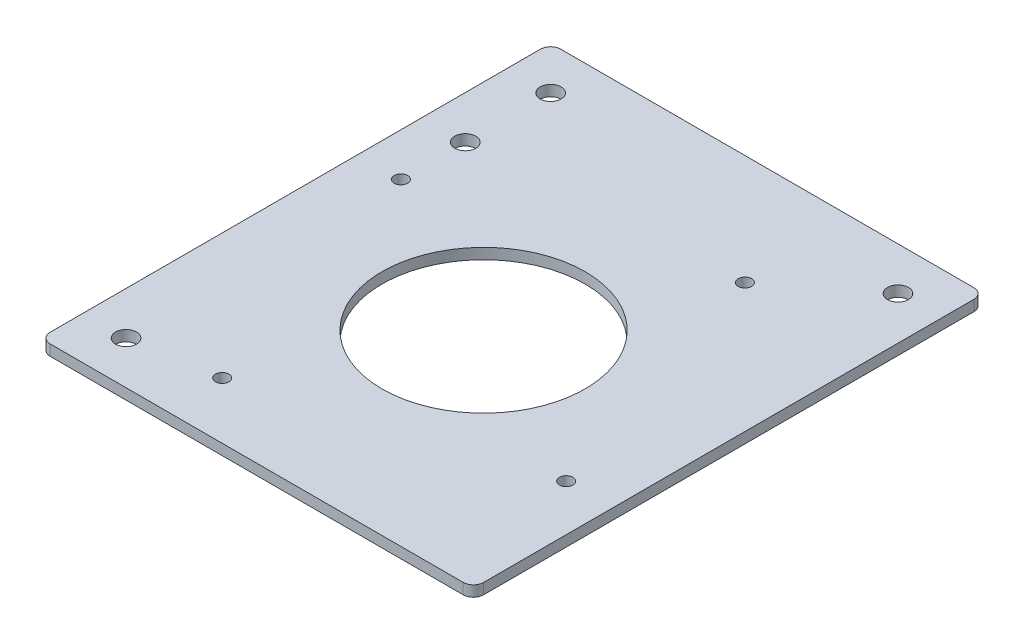
from build123d import *

# Parameters (mm, degrees)
SKETCH1_W           = 128
SKETCH1_H           = 150.8
SKETCH1_R           = 30
SKETCH1_R_2         = 3.1
BOSS_EXTRUDE1_DEPTH = 3.175
FILLET1_R           = 3
SKETCH3_R           = 1.985
CUT_EXTRUDE1_DEPTH  = 637.61018671


with BuildPart() as part:
    # Sketch1 → Boss-Extrude1 (new body)
    with BuildSketch(Plane(origin=(0, 0, 0), x_dir=(1, 0, 0), z_dir=(0, 1, 0))):
        with Locations((77.127334094, -545.362051651)):
            Rectangle(SKETCH1_W, SKETCH1_H)
        with Locations(Location((76.627334094, -553.262051651, 0), (0, 0, 270))):
            Circle(SKETCH1_R, mode=Mode.SUBTRACT)
        with Locations(Location((25.827334094, -482.662051651, 0), (0, 0, 270))):
            Circle(SKETCH1_R_2, mode=Mode.SUBTRACT)
        with Locations(Location((128.427334094, -482.662051651, 0), (0, 0, 270))):
            Circle(SKETCH1_R_2, mode=Mode.SUBTRACT)
        with Locations(Location((25.827334094, -608.062051651, 0), (0, 0, 270))):
            Circle(SKETCH1_R_2, mode=Mode.SUBTRACT)
        with Locations(Location((25.827334094, -507.862051651, 0), (0, 0, 270))):
            Circle(SKETCH1_R_2, mode=Mode.SUBTRACT)
    extrude(amount=BOSS_EXTRUDE1_DEPTH)

    # Fillet1
    fillet1_edges = [part.edges().sort_by_distance(p)[0] for p in [
        (141.127334094, 1.5875, 620.762051651),
        (13.127334094, 1.5875, 620.762051651),
        (13.127334094, 1.5875, 469.962051651),
        (141.127334094, 1.5875, 469.962051651),
    ]]
    fillet(fillet1_edges, radius=FILLET1_R)

    # Sketch3 → Cut-Extrude1 (cut, through all)
    with BuildSketch(Plane(origin=(0, 3.175, 0), x_dir=(1, 0, 0), z_dir=(0, 1, 0))):
        with Locations(Location((25.827334094, -526.868476675, 0), (0, 0, 270))):
            Circle(SKETCH3_R)
        with Locations(Location((103.020909069, -502.462051651, 0), (0, 0, 270))):
            Circle(SKETCH3_R)
        with Locations(Location((127.427334094, -579.655626627, 0), (0, 0, 270))):
            Circle(SKETCH3_R)
        with Locations(Location((50.233759118, -604.062051651, 0), (0, 0, 270))):
            Circle(SKETCH3_R)
    extrude(amount=-CUT_EXTRUDE1_DEPTH, mode=Mode.SUBTRACT)


solid = part.part
